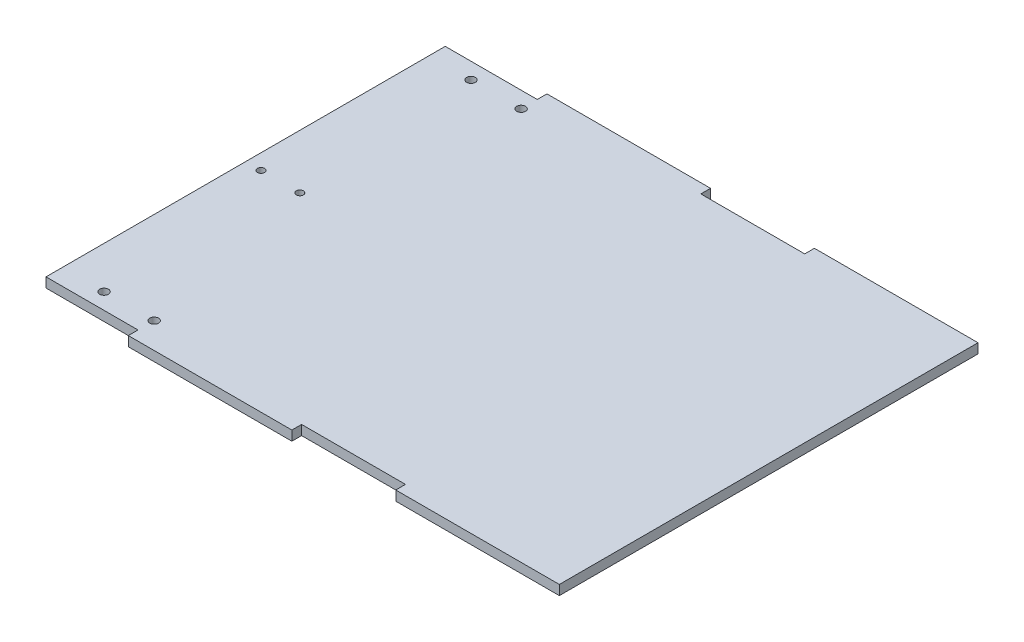
from build123d import *

# Parameters (mm, degrees)
EXTRUDE_1_DEPTH     = 4.75
SKETCH_3_R          = 1.75
CUT_EXTRUDE_1_DEPTH = 4.75
SKETCH_4_R          = 2.15
CUT_EXTRUDE_2_DEPTH = 4.75


with BuildPart() as part:
    # 草圖1 → 填料-伸長1 (new body)
    with BuildSketch(Plane(origin=(0, 0, 0), x_dir=(1, 0, 0), z_dir=(0, 1, 0))):
        Polygon((-105.4, 97.625), (-150.4, 97.625), (-150.4, -97.625), (-105.4, -97.625), (-105.4, -102.375), (-25.4, -102.375), (-25.4, -97.625), (25.4, -97.625), (25.4, -102.375), (105.4, -102.375), (105.4, -97.625), (105.4, 97.625), (105.4, 102.375), (25.4, 102.375), (25.4, 97.625), (-25.4, 97.625), (-25.4, 102.375), (-105.4, 102.375), align=None)
    extrude(amount=EXTRUDE_1_DEPTH)

    # 草圖3 → 除料-伸長1 (cut)
    with BuildSketch(Plane(origin=(0, 4.75, 0), x_dir=(1, 0, 0), z_dir=(0, 1, 0))):
        with Locations(Location((-123.9, 0, 0), (0, 0, 270))):
            Circle(SKETCH_3_R)
        with Locations(Location((-142.9, 0, 0), (0, 0, 270))):
            Circle(SKETCH_3_R)
    extrude(amount=-CUT_EXTRUDE_1_DEPTH, mode=Mode.SUBTRACT)

    # 草圖4 → 除料-伸長2 (cut)
    with BuildSketch(Plane(origin=(0, 4.75, 0), x_dir=(1, 0, 0), z_dir=(0, 1, 0))):
        with Locations(Location((-105.4, -89.725, 0), (0, 0, 270))):
            Circle(SKETCH_4_R)
        with Locations(Location((-129.9, -89.725, 0), (0, 0, 270))):
            Circle(SKETCH_4_R)
        with Locations(Location((-105.4, 89.725, 0), (0, 0, 270))):
            Circle(SKETCH_4_R)
        with Locations(Location((-129.9, 89.725, 0), (0, 0, 270))):
            Circle(SKETCH_4_R)
    extrude(amount=-CUT_EXTRUDE_2_DEPTH, mode=Mode.SUBTRACT)


solid = part.part
